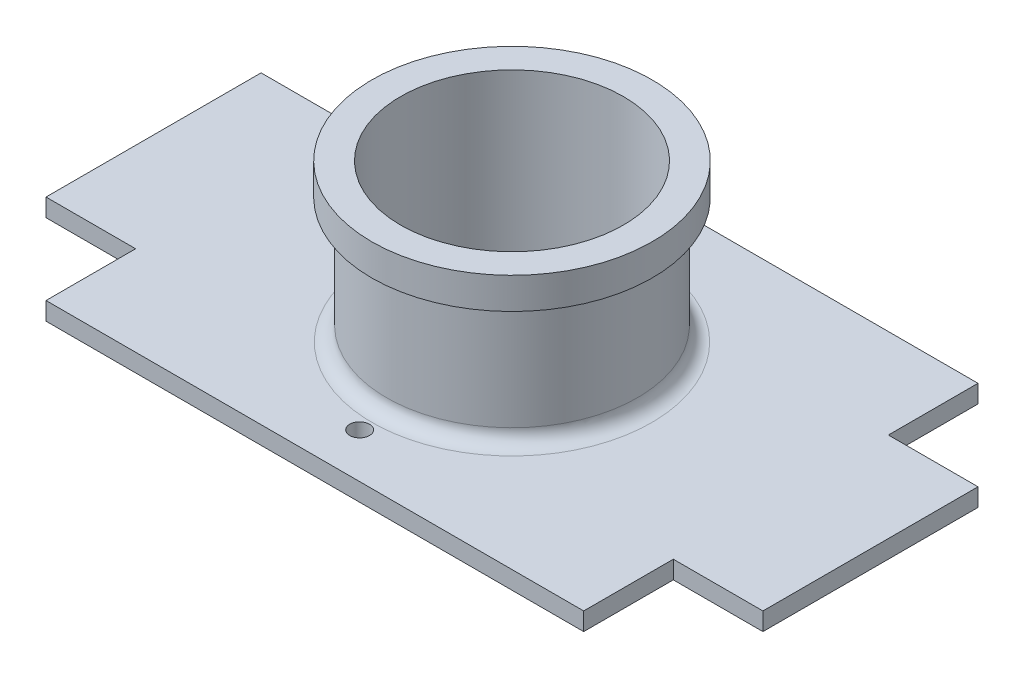
from build123d import *

# Parameters (mm, degrees)
SKETCH1_R           = 39.125
BOSS_EXTRUDE1_DEPTH = 8.75
SKETCH4_R           = 31.083201595
CUT_EXTRUDE1_DEPTH  = 9
BOSS_EXTRUDE3_START = 40
SKETCH5_R           = 35
SKETCH5_R_2         = 31.083201595
BOSS_EXTRUDE3_DEPTH = 40
SKETCH8_R           = 50
BOSS_EXTRUDE4_DEPTH = 5
SKETCH10_R          = 2.75
CUT_EXTRUDE2_DEPTH  = 5
CUT_EXTRUDE3_START  = -5
SKETCH11_R          = 31.083201595
CUT_EXTRUDE3_DEPTH  = 5
SKETCH12_R          = 2.75
SKETCH12_R_2        = 31.083201595
BOSS_EXTRUDE5_DEPTH = 5
FILLET2_R           = 4


with BuildPart() as part:
    # Sketch1 → Boss-Extrude1 (new body)
    with BuildSketch(Plane(origin=(0, 0, 0), x_dir=(1, 0, 0), z_dir=(0, 1, 0))):
        with Locations(Location((0, 0, 0), (0, 0, 270))):
            Circle(SKETCH1_R)
    extrude(amount=BOSS_EXTRUDE1_DEPTH)

    # Sketch4 → Cut-Extrude1 (cut)
    with BuildSketch(Plane.XZ):
        with Locations(Location((0, 0, 0), (0, 0, 270))):
            Circle(SKETCH4_R)
    extrude(amount=-CUT_EXTRUDE1_DEPTH, mode=Mode.SUBTRACT)

    # Sketch5 → Boss-Extrude3 (add)
    with BuildSketch(Plane.XZ.offset(BOSS_EXTRUDE3_START)):
        with Locations(Location((0, 0, 0), (0, 0, 270))):
            Circle(SKETCH5_R)
        with Locations(Location((0, 0, 0), (0, 0, 270))):
            Circle(SKETCH5_R_2, mode=Mode.SUBTRACT)
    extrude(amount=-BOSS_EXTRUDE3_DEPTH)

    # Sketch8 → Boss-Extrude4 (add)
    with BuildSketch(Plane.XZ.offset(40)):
        with Locations(Location((0, 0, 0), (0, 0, 270))):
            Circle(SKETCH8_R)
    extrude(amount=-BOSS_EXTRUDE4_DEPTH)

    # Sketch10 → Cut-Extrude2 (cut)
    with BuildSketch(Plane(origin=(0, -35, 0), x_dir=(1, 0, 0), z_dir=(0, 1, 0))):
        with Locations(Location((0, 42.5, 0), (0, 0, 270))):
            Circle(SKETCH10_R)
        with Locations(Location((42.5, 0, 0), (0, 0, 270))):
            Circle(SKETCH10_R)
        with Locations(Location((0, -42.5, 0), (0, 0, 270))):
            Circle(SKETCH10_R)
        with Locations(Location((-42.5, 0, 0), (0, 0, 270))):
            Circle(SKETCH10_R)
    extrude(amount=-CUT_EXTRUDE2_DEPTH, mode=Mode.SUBTRACT)

    # Sketch11 → Cut-Extrude3 (cut)
    with BuildSketch(Plane(origin=(0, -35, 0), x_dir=(1, 0, 0), z_dir=(0, 1, 0)).offset(CUT_EXTRUDE3_START)):
        with Locations(Location((0, 0, 0), (0, 0, 270))):
            Circle(SKETCH11_R)
    extrude(amount=CUT_EXTRUDE3_DEPTH, mode=Mode.SUBTRACT)

    # Sketch12 → Boss-Extrude5 (add)
    with BuildSketch(Plane.XZ.offset(40)):
        Polygon((-75, 55), (75, 55), (75, 30), (100, 30), (100, -30), (75, -30), (75, -55), (-75, -55), (-75, -30), (-100, -30), (-100, 30), (-75, 30), align=None)
        with Locations(Location((0, 42.5, 0), (0, 0, 90))):
            Circle(SKETCH12_R, mode=Mode.SUBTRACT)
        with Locations(Location((0, -42.5, 0), (0, 0, 90))):
            Circle(SKETCH12_R, mode=Mode.SUBTRACT)
        with Locations(Location((0, 0, 0), (0, 0, 90))):
            Circle(SKETCH12_R_2, mode=Mode.SUBTRACT)
    extrude(amount=-BOSS_EXTRUDE5_DEPTH)

    # Fillet2
    fillet2_edges = [part.edges().sort_by_distance(p)[0] for p in [
        (0, -35, 35),
    ]]
    fillet(fillet2_edges, radius=FILLET2_R)


solid = part.part
